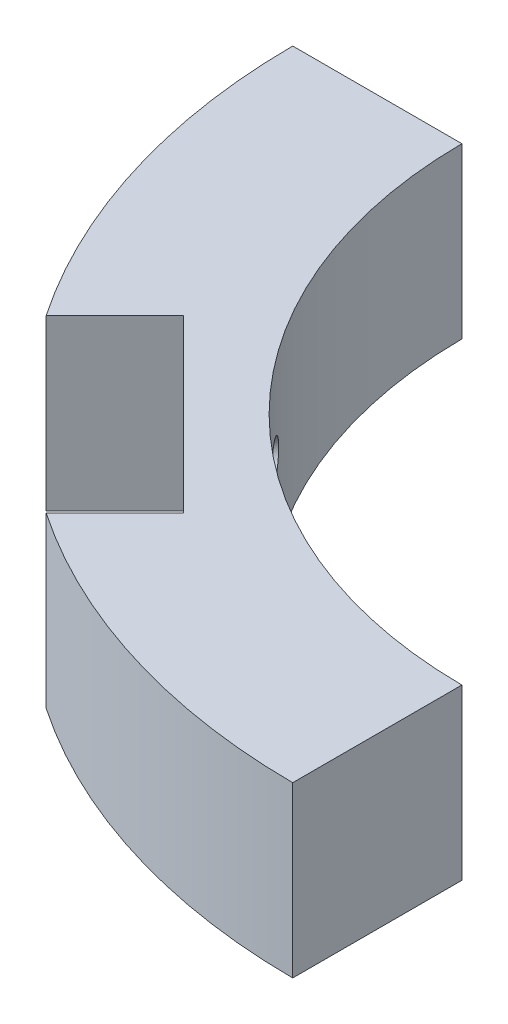
from build123d import *

# Parameters (mm, degrees)
BOSS_EXTRUDE1_DEPTH                   = 3.5
CUT_EXTRUDE1_DEPTH                    = 39.124532784
TAP_DRILL_FOR_M2X0_4_TAP1_D           = 1.6
TAP_DRILL_FOR_M2X0_4_TAP1_ON_FACE_2_D = 1.6


with BuildPart() as part:
    # Sketch1 → Boss-Extrude1 (new, symmetric)
    with BuildSketch(Plane(origin=(0, 0, 0), x_dir=(1, 0, 0), z_dir=(0, 1, 0))):
        with BuildLine():
            Line((-19.499743588, -0.1), (-26.49981132, -0.1))
            ThreePointArc((-26.49981132, -0.1), (-18.738329701, -18.738329701), (-0.1, -26.49981132))
            Line((-0.1, -26.49981132), (-0.1, -19.499743588))
            ThreePointArc((-0.1, -19.499743588), (-13.788582233, -13.788582233), (-19.499743588, -0.1))
        make_face()
    extrude(amount=BOSS_EXTRUDE1_DEPTH, both=True)

    # Sketch2 → Cut-Extrude1 (cut, through all)
    with BuildSketch(Plane(origin=(0, 3.5, 0), x_dir=(1, 0, 0), z_dir=(0, 1, 0))):
        Polygon((-22.273863607, -15.202795796), (-15.202795796, -22.273863607), (-12.02081528, -19.091883092), (-19.091883092, -12.02081528), align=None)
    extrude(amount=-CUT_EXTRUDE1_DEPTH, mode=Mode.SUBTRACT)

    # Tap Drill for M2x0.4 Tap1 (through all)
    with Locations(Plane(origin=(-17.324116139, 0, 13.788582233), x_dir=(0.707106781187, 0, 0.707106781187), z_dir=(-0.707106781187, 0, 0.707106781187))):
        with Locations((0, 0)):
            Hole(TAP_DRILL_FOR_M2X0_4_TAP1_D / 2)

    # Tap Drill for M2x0.4 Tap1 on face 2 (through all)
    with Locations(Plane(origin=(-13.788582233, 0, 17.324116139), x_dir=(0.707106781187, 0, 0.707106781187), z_dir=(-0.707106781187, 0, 0.707106781187))):
        with Locations((0, 0)):
            Hole(TAP_DRILL_FOR_M2X0_4_TAP1_ON_FACE_2_D / 2)


solid = part.part
